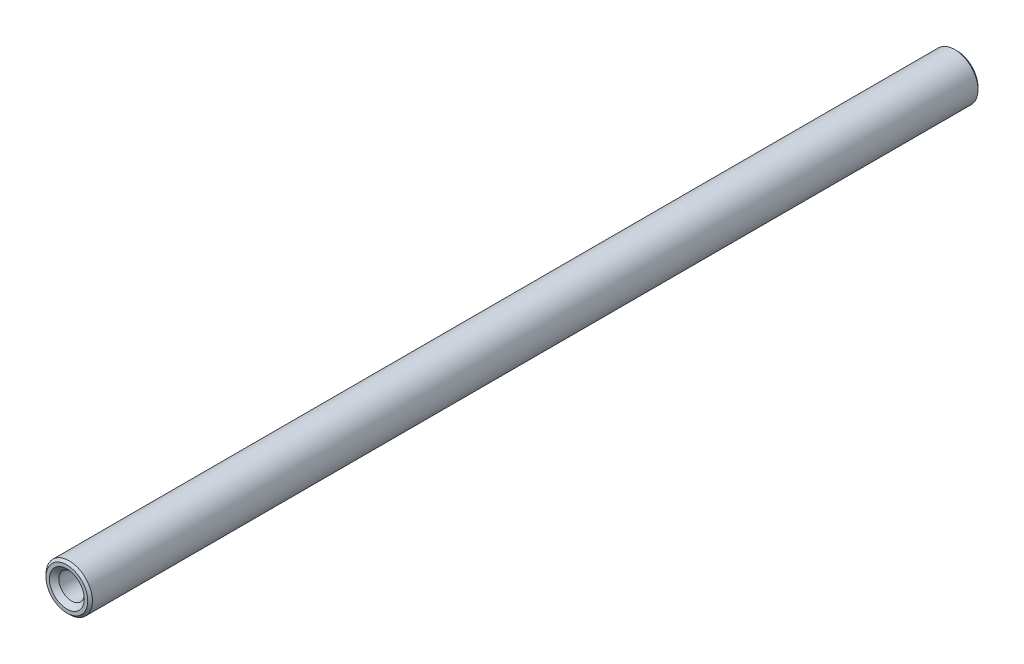
from build123d import *

# Parameters (mm, degrees)
SKETCH_236_R                = 3
EXTRUDE_290_DEPTH           = 115
HOLE_WIZARD_M41_D           = 3.3
HOLE_WIZARD_M41_DEPTH       = 12
HOLE_WIZARD_M41_CSINK_D     = 4.5
HOLE_WIZARD_M41_CSINK_ANGLE = 90
HOLE_WIZARD_M41_TIP         = 0.991420021
HOLE_WIZARD_M42_D           = 3.3
HOLE_WIZARD_M42_DEPTH       = 12
HOLE_WIZARD_M42_CSINK_D     = 4.5
HOLE_WIZARD_M42_CSINK_ANGLE = 90
HOLE_WIZARD_M42_TIP         = 0.991420021
CHAMFER_1_SIZE              = 0.3


with BuildPart() as part:
    # Sketch 236 → Extrude 290 (new body)
    with BuildSketch(Plane.XY):
        Circle(SKETCH_236_R)
    extrude(amount=EXTRUDE_290_DEPTH)

    # Отверстие обработанное метчиком M41
    with Locations(Plane.XY.offset(115)):
        with Locations((0, 0)):
            CounterSinkHole(HOLE_WIZARD_M41_D / 2, HOLE_WIZARD_M41_CSINK_D / 2, depth=HOLE_WIZARD_M41_DEPTH, counter_sink_angle=HOLE_WIZARD_M41_CSINK_ANGLE)
            with Locations((0, 0, -(HOLE_WIZARD_M41_DEPTH + HOLE_WIZARD_M41_TIP / 2))):  # 118° drill point
                Cone(0, HOLE_WIZARD_M41_D / 2, HOLE_WIZARD_M41_TIP, mode=Mode.SUBTRACT)

    # Отверстие обработанное метчиком M42
    with Locations(Plane(origin=(0, 0, 0), x_dir=(-1, 0, 0), z_dir=(0, 0, -1))):
        with Locations((0, 0)):
            CounterSinkHole(HOLE_WIZARD_M42_D / 2, HOLE_WIZARD_M42_CSINK_D / 2, depth=HOLE_WIZARD_M42_DEPTH, counter_sink_angle=HOLE_WIZARD_M42_CSINK_ANGLE)
            with Locations((0, 0, -(HOLE_WIZARD_M42_DEPTH + HOLE_WIZARD_M42_TIP / 2))):  # 118° drill point
                Cone(0, HOLE_WIZARD_M42_D / 2, HOLE_WIZARD_M42_TIP, mode=Mode.SUBTRACT)

    # Фаска1
    chamfer_1_edges = [part.edges().sort_by_distance(p)[0] for p in [
        (-3, 0, 0),
        (-3, 0, 115),
    ]]
    chamfer(chamfer_1_edges, length=CHAMFER_1_SIZE)


solid = part.part
